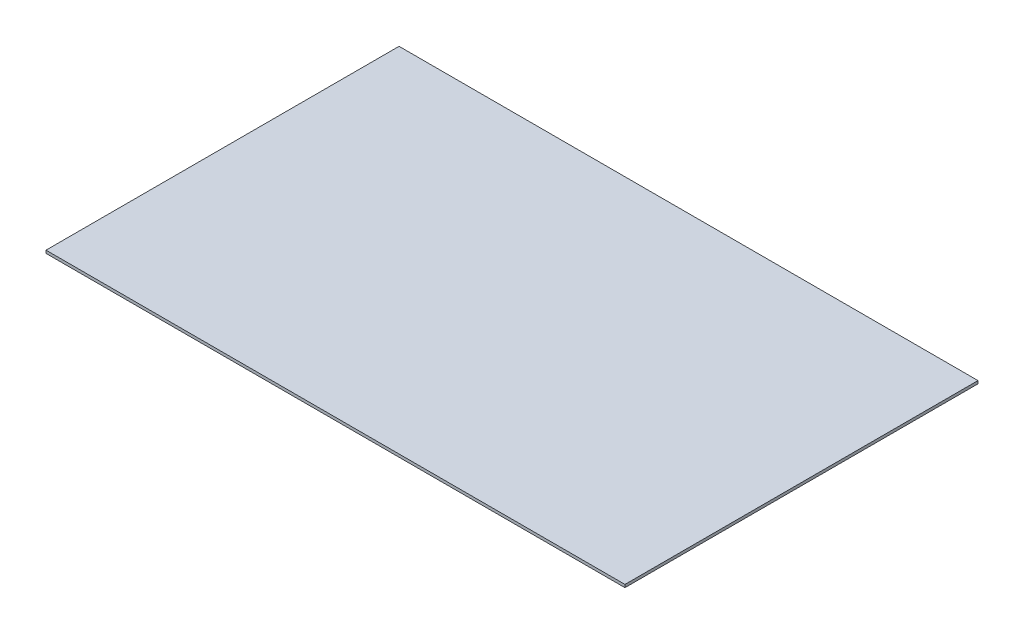
from build123d import *

# Parameters (mm, degrees)
SKETCH1_W           = 510
SKETCH1_H           = 311
BOSS_EXTRUDE1_DEPTH = 1.25


with BuildPart() as part:
    # Sketch1 → Boss-Extrude1 (new, symmetric)
    with BuildSketch(Plane(origin=(0, 0, 0), x_dir=(1, 0, 0), z_dir=(0, 1, 0))):
        Rectangle(SKETCH1_W, SKETCH1_H)
    extrude(amount=BOSS_EXTRUDE1_DEPTH, both=True)


solid = part.part
